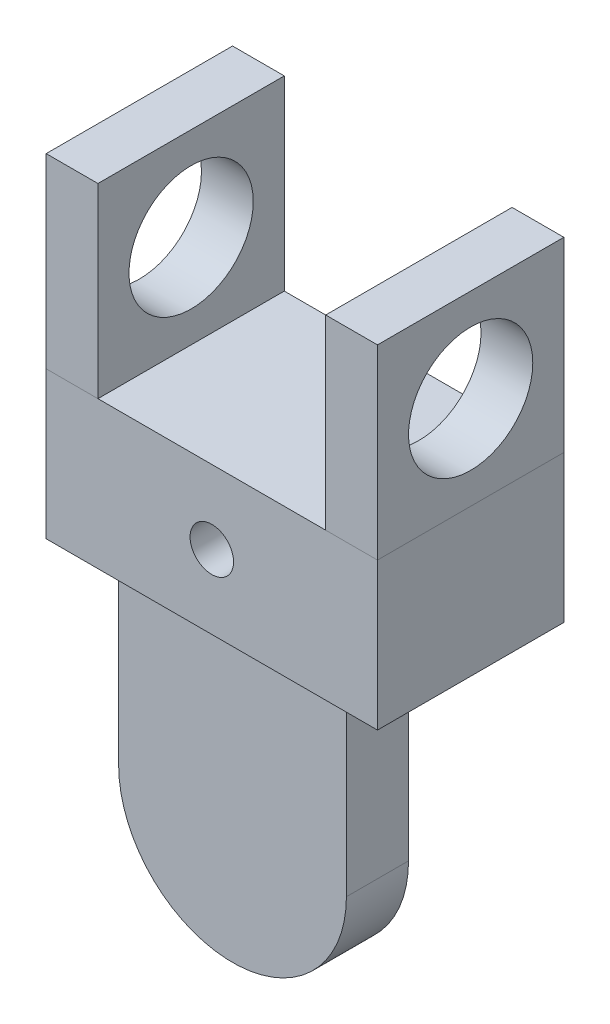
from build123d import *

# Parameters (mm, degrees)
SKETCH1_R           = 1.505
BOSS_EXTRUDE1_DEPTH = 3.1
SKETCH2_R           = 5.5
SKETCH2_R_2         = 1.505
BOSS_EXTRUDE2_DEPTH = 3
SKETCH3_W           = 11
SKETCH3_H           = 3
BOSS_EXTRUDE4_DEPTH = 7.11
F_3DSKETCH1_R       = 3
BOSS_EXTRUDE5_DEPTH = 2.5
F_3DSKETCH2_R       = 3
BOSS_EXTRUDE6_DEPTH = 2.5
SKETCH4_R           = 1.05
CUT_EXTRUDE1_DEPTH  = 9


with BuildPart() as part:
    # Sketch1 → Boss-Extrude1 (new body)
    with BuildSketch(Plane.XY):
        with Locations(Location((0, 0, 0), (0, 0, 180))):
            Circle(SKETCH1_R)
    extrude(amount=BOSS_EXTRUDE1_DEPTH)


with BuildPart() as body_2:
    # Sketch2 → Boss-Extrude2 (new body)
    # profile 1 of 3: a face of its own
    with BuildSketch(Plane.XY.offset(3.1)):
        Circle(SKETCH2_R)
        with Locations(Location((0, 0, 0), (0, 0, 180))):
            Circle(SKETCH2_R_2, mode=Mode.SUBTRACT)
    # profile 2 of 3: a face of its own
    with BuildSketch(Plane.XY.offset(3.1)):
        with Locations(Location((0, 0, 0), (0, 0, 180))):
            Circle(SKETCH2_R_2)
    # profile 3 of 3: a face of its own
    with BuildSketch(Plane.XY.offset(3.1)):
        with BuildLine():
            Line((-5.5, 8.72), (-5.5, 0))
            ThreePointArc((-5.5, 0), (0, 5.5), (5.5, 0))
            Line((5.5, 0), (5.5, 8.72))
            Line((5.5, 8.72), (-5.5, 8.72))
        make_face()
    extrude(amount=BOSS_EXTRUDE2_DEPTH)


with BuildPart() as body_3:
    # Sketch3 → Boss-Extrude4 (new body)
    with BuildSketch(Plane(origin=(0, 8.72, 0), x_dir=(1, 0, 0), z_dir=(0, 1, 0))):
        with Locations((0, -4.6)):
            Rectangle(SKETCH3_W, SKETCH3_H)
        Polygon((5.5, -6.1), (8, -6.1), (8, 1.9), (-8, 1.9), (-8, -6.1), (-5.5, -6.1), (-5.5, -3.1), (5.5, -3.1), align=None)
        Polygon((-8, -6.1), (-8, -7.1), (8, -7.1), (8, -6.1), (5.5, -6.1), (-5.5, -6.1), align=None)
    extrude(amount=BOSS_EXTRUDE4_DEPTH)

    # Sketch4 → Cut-Extrude1 (cut)
    with BuildSketch(Plane(origin=(0, 0, -1.9), x_dir=(-1, 0, 0), z_dir=(0, 0, -1))):
        with Locations((0, 12.275)):
            Circle(SKETCH4_R)
    extrude(amount=-CUT_EXTRUDE1_DEPTH, mode=Mode.SUBTRACT)


with BuildPart() as body_4:
    # 3DSketch1 → Boss-Extrude5 (new body)
    with BuildSketch(Plane(origin=(-8, 15.83, -1.9), x_dir=(0, 0.7071067811865475, 0.7071067811865476), z_dir=(-1, 0, 0))):
        Polygon((0, 0), (6.363961031, 6.363961031), (12.727922061, 0), (6.363961031, -6.363961031), align=None)
        with Locations(Location((6.363961031, 0, 0), (0, 0, 135))):
            Circle(F_3DSKETCH1_R, mode=Mode.SUBTRACT)
    extrude(amount=-BOSS_EXTRUDE5_DEPTH)


with BuildPart() as body_5:
    # 3DSketch2 → Boss-Extrude6 (new body)
    with BuildSketch(Plane(origin=(8, 15.83, 7.1), x_dir=(0, 0.7071067811865475, -0.7071067811865476), z_dir=(1, 0, 0))):
        Polygon((0, 0), (6.363961031, 6.363961031), (12.727922061, 0), (6.363961031, -6.363961031), align=None)
        with Locations(Location((6.363961031, 0, 0), (0, 0, 315))):
            Circle(F_3DSKETCH2_R, mode=Mode.SUBTRACT)
    extrude(amount=-BOSS_EXTRUDE6_DEPTH)


solid = Compound([part.part, body_2.part, body_3.part, body_4.part, body_5.part])
